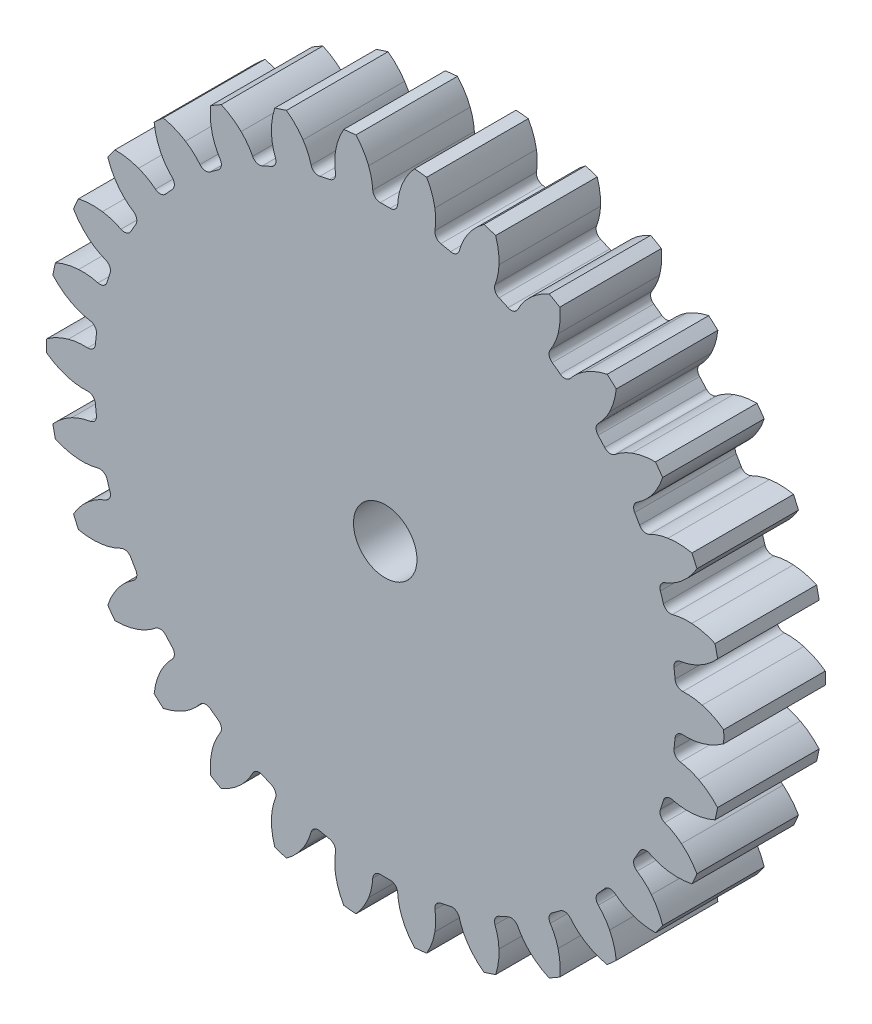
from build123d import *

# Parameters (mm, degrees)
SKETCH1_R        = 50.8
GEAR_BASE_DEPTH  = 7.62
GEAR_CUT_DEPTH   = 74.440708058
GEAR_TEETH_COUNT = 30
SKETCH3_R        = 4.7625
BORE_DEPTH       = 74.308992556


with BuildPart() as part:
    # Sketch1 → GEAR_BASE (new, symmetric)
    with BuildSketch(Plane.XY):
        Circle(SKETCH1_R)
    extrude(amount=GEAR_BASE_DEPTH, both=True)

    # Sketch2 → GEAR_CUT (cut, through all)
    with BuildSketch(Plane.XY.offset(7.62)):
        with BuildLine():
            ThreePointArc((-49.872591357, -9.662537522), (-50.521712285, -5.310045934), (-50.791710092, -0.917706901))
            ThreePointArc((-50.791710092, -0.917706901), (-49.247291805, -1.852666983), (-47.559654919, -2.4939625))
            ThreePointArc((-47.559654919, -2.4939625), (-46.120309896, -2.772253488), (-44.654879163, -2.813152568))
            ThreePointArc((-44.654879163, -2.813152568), (-43.86698879, -3.08349419), (-43.488323172, -3.825429621))
            ThreePointArc((-43.488323172, -3.825429621), (-43.417096495, -4.563320725), (-43.333350511, -5.299895996))
            ThreePointArc((-43.333350511, -5.299895996), (-43.549484327, -6.104347366), (-44.263950221, -6.532592995))
            ThreePointArc((-44.263950221, -6.532592995), (-45.68885438, -6.877278514), (-47.038886311, -7.448744833))
            ThreePointArc((-47.038886311, -7.448744833), (-48.556311447, -8.426905943), (-49.872591357, -9.662537522))
        make_face()
    gear_cut = extrude(amount=-GEAR_CUT_DEPTH, mode=Mode.SUBTRACT)

    # GEAR_TEETH: GEAR_CUT ×30 about axis
    gear_teeth_axis = Axis((0, 0, -1.397), (0, 0, 1))
    for i in range(1, GEAR_TEETH_COUNT):
        add(gear_cut.rotate(gear_teeth_axis, i * 360 / GEAR_TEETH_COUNT), mode=Mode.SUBTRACT)

    # Sketch3 → BORE (cut, through all)
    with BuildSketch(Plane.XY.offset(7.62)):
        Circle(SKETCH3_R)
    extrude(amount=-BORE_DEPTH, mode=Mode.SUBTRACT)


solid = part.part
